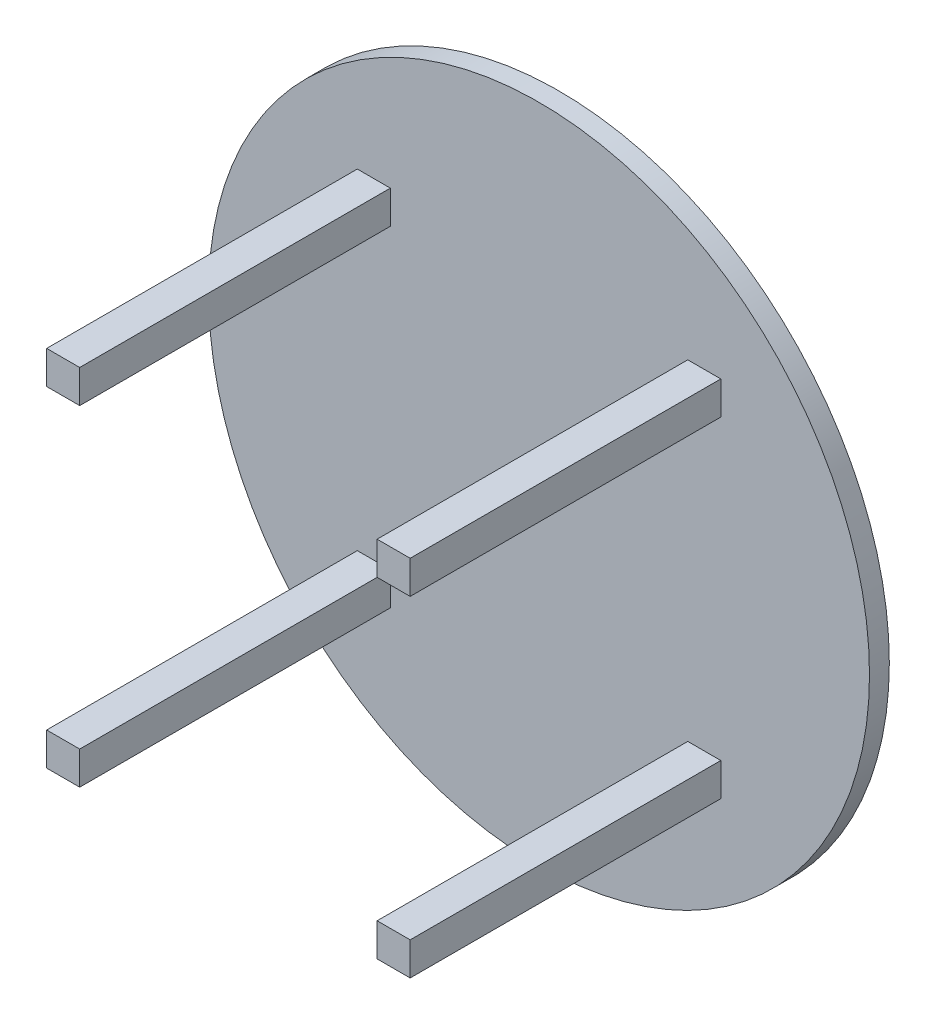
from build123d import *

# Parameters (mm, degrees)
SKETCH_1_R      = 500
EXTRUDE_1_DEPTH = 30
SKETCH_2_W      = 50
SKETCH_2_H      = 50
EXTRUDE_2_DEPTH = 500
SKETCH_3_W      = 50
SKETCH_3_H      = 50
EXTRUDE_3_DEPTH = 500
SKETCH_4_W      = 50
SKETCH_4_H      = 50
EXTRUDE_4_DEPTH = 500
SKETCH_5_W      = 50
SKETCH_5_H      = 50
EXTRUDE_5_DEPTH = 500


with BuildPart() as part:
    # 草图1 → 凸台-拉伸1 (new body)
    with BuildSketch(Plane.XY):
        Circle(SKETCH_1_R)
    extrude(amount=EXTRUDE_1_DEPTH)

    # 草图2 → 凸台-拉伸2 (add)
    with BuildSketch(Plane.XY):
        with Locations((250, 250)):
            Rectangle(SKETCH_2_W, SKETCH_2_H)
    extrude(amount=EXTRUDE_2_DEPTH)

    # 草图3 → 凸台-拉伸3 (add)
    with BuildSketch(Plane.XY):
        with Locations((250, -250)):
            Rectangle(SKETCH_3_W, SKETCH_3_H)
    extrude(amount=EXTRUDE_3_DEPTH)

    # 草图4 → 凸台-拉伸4 (add)
    with BuildSketch(Plane.XY):
        with Locations((-250, 250)):
            Rectangle(SKETCH_4_W, SKETCH_4_H)
    extrude(amount=EXTRUDE_4_DEPTH)

    # 草图5 → 凸台-拉伸5 (add)
    with BuildSketch(Plane.XY):
        with Locations((-250, -250)):
            Rectangle(SKETCH_5_W, SKETCH_5_H)
    extrude(amount=EXTRUDE_5_DEPTH)


solid = part.part
